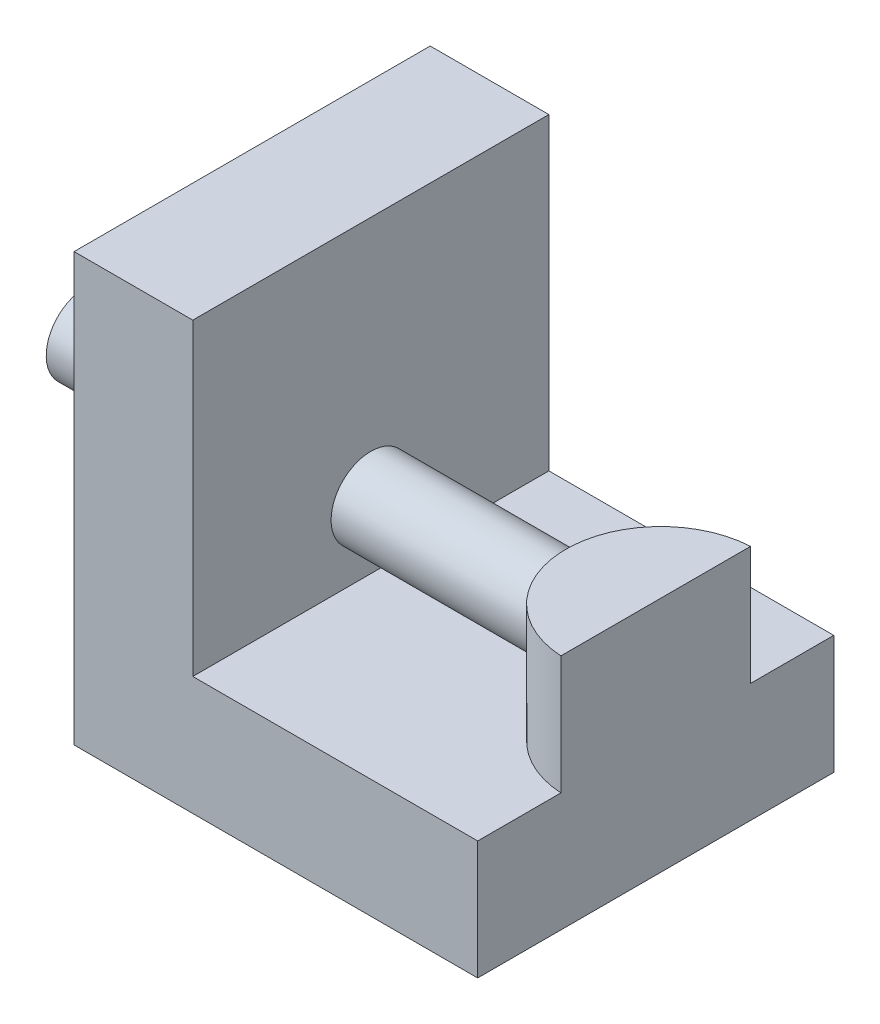
from build123d import *

# Parameters (mm, degrees)
EXTRUDE_1_DEPTH          = 15
SKETCH_3_R               = 8
EXTRUDE_2_DEPTH          = 10
CUT_EXTRUDE_3_DEPTH      = 68.089492471
CUT_EXTRUDE_3_DEPTH_BACK = 68.089492471
SKETCH_4_W               = 25.997124379
SKETCH_4_H               = 30
EXTRUDE_START            = -24
SKETCH_5_R               = 3.349390617
EXTRUDE_13_DEPTH         = 41.166654


with BuildPart() as part:
    # 草图2 → 凸台-拉伸1 (new, symmetric)
    with BuildSketch(Plane.XY):
        Polygon((0, 0), (0, -36), (60, -36), (60, -26), (10, -26), (10, 0), align=None)
    extrude(amount=EXTRUDE_1_DEPTH, both=True)

    # 草图3 → 凸台-拉伸2 (add, symmetric)
    with BuildSketch(Plane(origin=(0, -26, 0), x_dir=(1, 0, 0), z_dir=(0, 1, 0))):
        with Locations((34.431755152, 0)):
            Circle(SKETCH_3_R)
    extrude(amount=EXTRUDE_2_DEPTH, both=True)

    # 草图4 → 切除-拉伸3 (cut, two sides: drawn at the far end of the back side and taken through both)
    with BuildSketch(Plane(origin=(0, -26, 0), x_dir=(1, 0, 0), z_dir=(0, 1, 0)).offset(-CUT_EXTRUDE_3_DEPTH_BACK)):
        with Locations((47.001437811, 0)):
            Rectangle(SKETCH_4_W, SKETCH_4_H)
    extrude(amount=CUT_EXTRUDE_3_DEPTH + CUT_EXTRUDE_3_DEPTH_BACK, mode=Mode.SUBTRACT)

    # 草图5 → 凸台-拉伸13 (add)
    with BuildSketch(Plane(origin=(10, 0, 0), x_dir=(0, 0, -1), z_dir=(1, 0, 0)).offset(EXTRUDE_START)):
        with Locations(Location((0, -20.42358982, 0), (0, 0, 90))):
            Circle(SKETCH_5_R)
    extrude(amount=EXTRUDE_13_DEPTH)


solid = part.part
